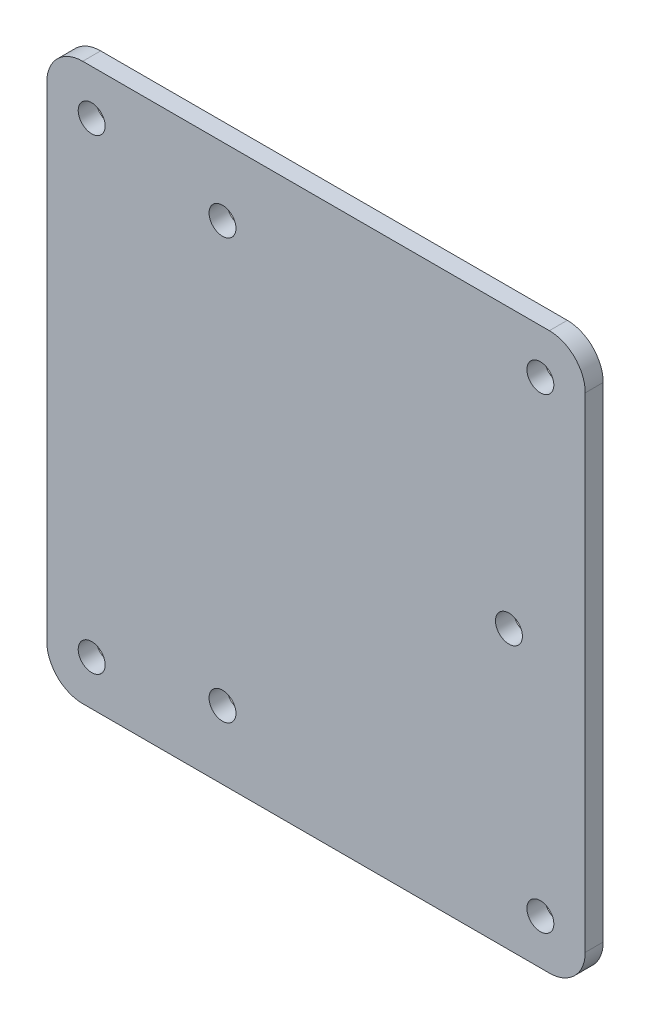
from build123d import *

# Parameters (mm, degrees)
CROQUIS1_W              = 60
CROQUIS1_H              = 62
CROQUIS1_R              = 1.5
SALIENTE_EXTRUIR1_DEPTH = 2
REDONDEO1_R             = 4
CROQUIS3_R              = 1.5
CORTAR_EXTRUIR1_DEPTH   = 2


with BuildPart() as part:
    # Croquis1 → Saliente-Extruir1 (new body)
    with BuildSketch(Plane.XY):
        Rectangle(CROQUIS1_W, CROQUIS1_H)
        with Locations((-25, -26)):
            Circle(CROQUIS1_R, mode=Mode.SUBTRACT)
        with Locations((25, -26)):
            Circle(CROQUIS1_R, mode=Mode.SUBTRACT)
        with Locations((25, 26)):
            Circle(CROQUIS1_R, mode=Mode.SUBTRACT)
        with Locations((-25, 26)):
            Circle(CROQUIS1_R, mode=Mode.SUBTRACT)
    extrude(amount=SALIENTE_EXTRUIR1_DEPTH)

    # Redondeo1
    redondeo1_edges = [part.edges().sort_by_distance(p)[0] for p in [
        (-30, -31, 1),
        (-30, 31, 1),
        (30, 31, 1),
        (30, -31, 1),
    ]]
    fillet(redondeo1_edges, radius=REDONDEO1_R)

    # Croquis3 → Cortar-Extruir1 (cut)
    with BuildSketch(Plane.XY.offset(2)):
        with Locations((-10.42, 23.4)):
            Circle(CROQUIS3_R)
        with Locations((-10.42, -23.4)):
            Circle(CROQUIS3_R)
        with Locations((21.5, 0)):
            Circle(CROQUIS3_R)
    extrude(amount=-CORTAR_EXTRUIR1_DEPTH, mode=Mode.SUBTRACT)


solid = part.part
